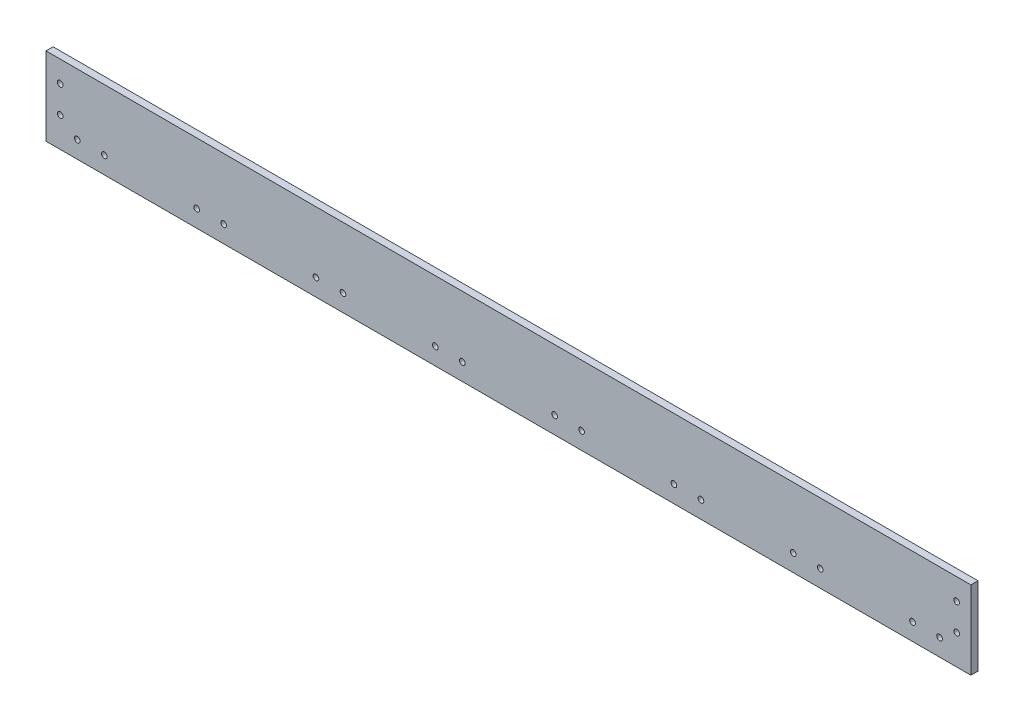
from build123d import *

# Parameters (mm, degrees)
SKETCH1_W           = 825.5
SKETCH1_H           = 69.85
BOSS_EXTRUDE1_DEPTH = 6.35
SKETCH2_R           = 2.54
CUT_EXTRUDE1_DEPTH  = 6.35
SKETCH3_R           = 2.54
CUT_EXTRUDE2_DEPTH  = 6.35
LPATTERN2_COUNT     = 8
LPATTERN2_PITCH     = 106.498571429


with BuildPart() as part:
    # Sketch1 → Boss-Extrude1 (new body)
    with BuildSketch(Plane.XY):
        with Locations((412.75, 34.925)):
            Rectangle(SKETCH1_W, SKETCH1_H)
    extrude(amount=BOSS_EXTRUDE1_DEPTH)

    # Sketch2 → Cut-Extrude1 (cut)
    with BuildSketch(Plane.XY.offset(6.35)):
        with Locations((27.94, 15.24)):
            Circle(SKETCH2_R)
        with Locations((52.07, 15.24)):
            Circle(SKETCH2_R)
    cut_extrude1 = extrude(amount=-CUT_EXTRUDE1_DEPTH, mode=Mode.SUBTRACT)

    # Sketch3 → Cut-Extrude2 (cut)
    with BuildSketch(Plane.XY.offset(6.35)):
        with Locations((12.7, 26.67)):
            Circle(SKETCH3_R)
        with Locations((12.7, 50.8)):
            Circle(SKETCH3_R)
        with Locations(Location((812.8, 26.67, 0), (0, 0, 180))):
            Circle(SKETCH3_R)
        with Locations(Location((812.8, 50.8, 0), (0, 0, 180))):
            Circle(SKETCH3_R)
    extrude(amount=-CUT_EXTRUDE2_DEPTH, mode=Mode.SUBTRACT)

    # LPattern2: Cut-Extrude1 ×8
    with Locations(*[(i * LPATTERN2_PITCH, 0, 0) for i in range(1, LPATTERN2_COUNT)]):
        add(cut_extrude1, mode=Mode.SUBTRACT)


solid = part.part
